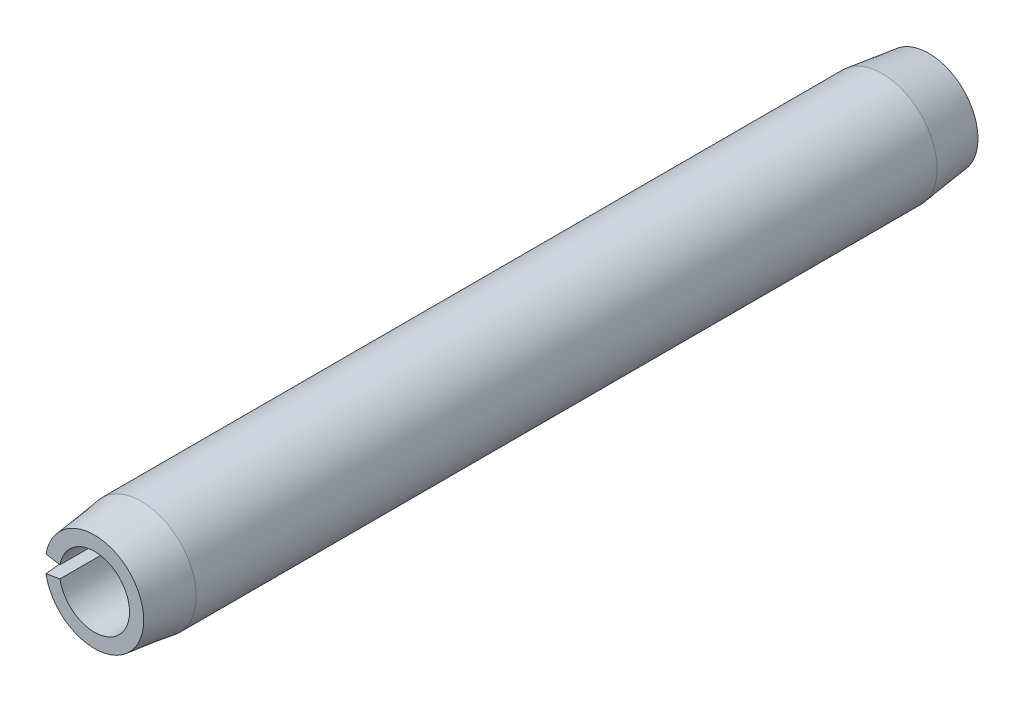
from build123d import *

# Parameters (mm, degrees)
EXTRUDE1_DEPTH = 6.35


with BuildPart() as part:
    # Sketch1 → Extrude1 (new, symmetric)
    with BuildSketch(Plane.XY):
        with BuildLine():
            Line((-0.825465859, 0.145551903), (-0.525296455, 0.092623938))
            ThreePointArc((-0.525296455, 0.092623938), (0.5334, 0), (-0.525296455, -0.092623938))
            Line((-0.525296455, -0.092623938), (-0.825465859, -0.145551903))
            ThreePointArc((-0.825465859, -0.145551903), (0.8382, 0), (-0.825465859, 0.145551903))
        make_face()
    extrude(amount=EXTRUDE1_DEPTH, both=True)

    # Sketch2 → Cut-Revolve1 (revolve, cut)
    with BuildSketch(Plane(origin=(0, 0, 0), x_dir=(0, 0, -1), z_dir=(1, 0, 0))):
        Polygon((6.35, 0.8382), (6.35, 0.7493), (5.6388, 0.8382), align=None)
        Polygon((-5.6388, 0.8382), (-6.35, 0.8382), (-6.35, 0.7493), align=None)
    revolve(axis=Axis((0, 0, -6.35), (0, 0, 1)), mode=Mode.SUBTRACT)


solid = part.part
